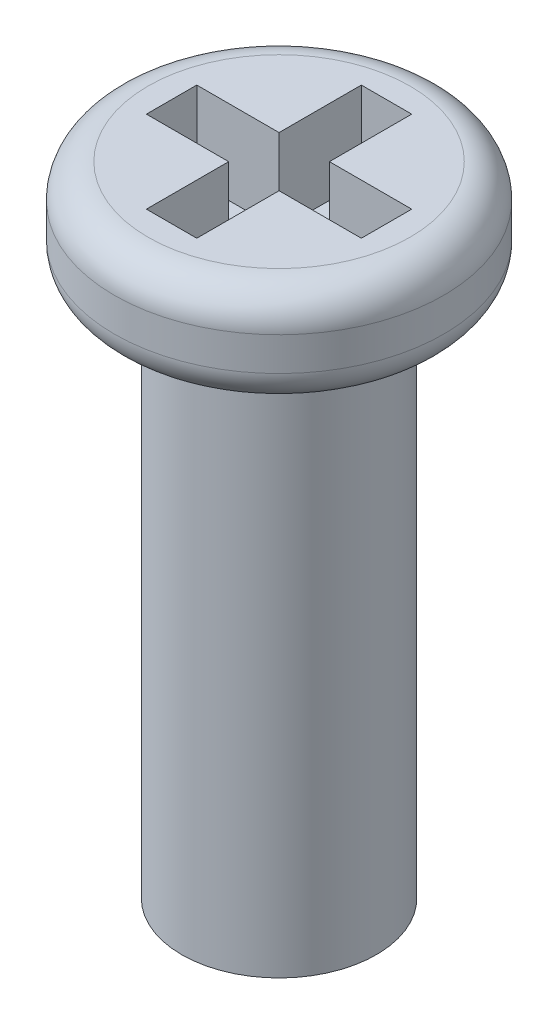
from build123d import *

# Parameters (mm, degrees)
SKETCH1_R           = 1.45
BOSS_EXTRUDE1_DEPTH = 8
SKETCH2_R           = 2.45
BOSS_EXTRUDE2_DEPTH = 1.5
FILLET1_R           = 0.5
SKETCH3_W           = 0.75
SKETCH3_H           = 1.225
SKETCH3_H_2         = 0.75
SKETCH3_W_2         = 1.225
CUT_EXTRUDE1_DEPTH  = 1.25
FILLET4_R           = 0.5


with BuildPart() as part:
    # Sketch1 → Boss-Extrude1 (new body)
    with BuildSketch(Plane(origin=(0, 0, 0), x_dir=(1, 0, 0), z_dir=(0, 1, 0))):
        with Locations(Location((0, 0, 0), (0, 0, 270))):
            Circle(SKETCH1_R)
    extrude(amount=BOSS_EXTRUDE1_DEPTH)

    # Sketch2 → Boss-Extrude2 (add)
    with BuildSketch(Plane(origin=(0, 8, 0), x_dir=(1, 0, 0), z_dir=(0, 1, 0))):
        with Locations(Location((0, 0, 0), (0, 0, 270))):
            Circle(SKETCH2_R)
    extrude(amount=BOSS_EXTRUDE2_DEPTH)

    # Fillet1
    fillet1_edges = [part.edges().sort_by_distance(p)[0] for p in [
        (0, 8, -2.45),
        (0, 9.5, -2.45),
    ]]
    fillet(fillet1_edges, radius=FILLET1_R)

    # Sketch3 → Cut-Extrude1 (cut)
    with BuildSketch(Plane(origin=(0, 9.5, 0), x_dir=(1, 0, 0), z_dir=(0, 1, 0))):
        with Locations((0, 0.9875)):
            Rectangle(SKETCH3_W, SKETCH3_H)
        Rectangle(SKETCH3_W, SKETCH3_H_2)
        with Locations((0, -0.9875)):
            Rectangle(SKETCH3_W, SKETCH3_H)
        with Locations((0.9875, 0)):
            Rectangle(SKETCH3_W_2, SKETCH3_H_2)
        with Locations((-0.9875, 0)):
            Rectangle(SKETCH3_W_2, SKETCH3_H_2)
    extrude(amount=-CUT_EXTRUDE1_DEPTH, mode=Mode.SUBTRACT)

    # Fillet4
    fillet4_edges = [part.edges().sort_by_distance(p)[0] for p in [
        (0, 8.25, 1.6),
        (-1.6, 8.25, 0),
        (0, 8.25, -1.6),
        (1.6, 8.25, 0),
    ]]
    fillet(fillet4_edges, radius=FILLET4_R)


solid = part.part
